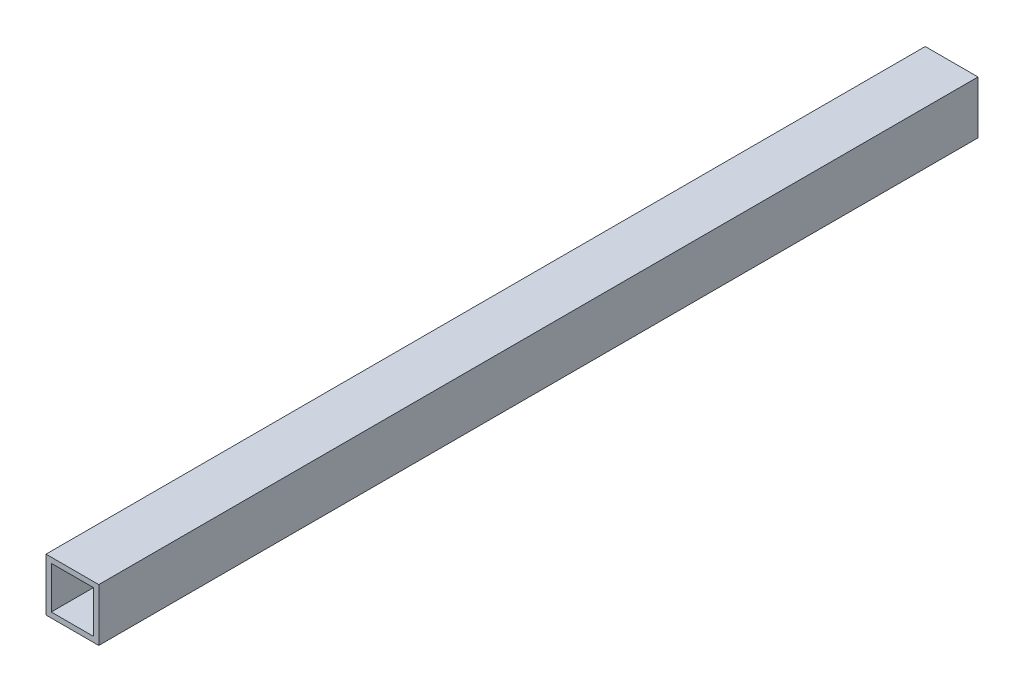
from build123d import *

# Parameters (mm, degrees)
SKETCH_1_W      = 15
SKETCH_1_H      = 15
SKETCH_1_W_2    = 12
SKETCH_1_H_2    = 12
EXTRUDE_1_DEPTH = 250


with BuildPart() as part:
    # 草图1 → 拉伸-薄壁1 (new body)
    with BuildSketch(Plane.XY):
        Rectangle(SKETCH_1_W, SKETCH_1_H)
        Rectangle(SKETCH_1_W_2, SKETCH_1_H_2, mode=Mode.SUBTRACT)
    extrude(amount=EXTRUDE_1_DEPTH)


solid = part.part
